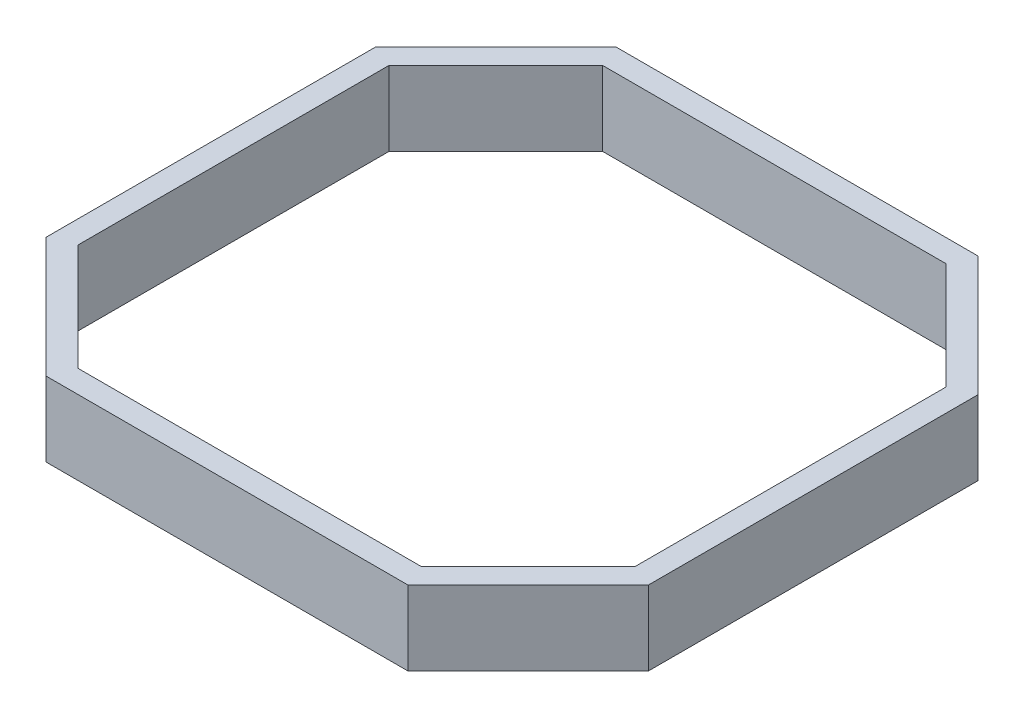
from build123d import *

# Parameters (mm, degrees)
BOSS_EXTRUDE1_DEPTH = 11.5


with BuildPart() as part:
    # Sketch1 → Boss-Extrude1 (new body)
    with BuildSketch(Plane(origin=(0, 0, 0), x_dir=(1, 0, 0), z_dir=(0, 1, 0))):
        Polygon((-46.5, 25.449747468), (-27.949747468, 44), (27.949747468, 44), (46.5, 25.449747468), (46.5, -25.449747468), (27.949747468, -44), (-27.949747468, -44), (-46.5, -25.449747468), align=None)
        Polygon((-43, 24), (-26.5, 40.5), (26.5, 40.5), (43, 24), (43, -24), (26.5, -40.5), (-26.5, -40.5), (-43, -24), align=None, mode=Mode.SUBTRACT)
    extrude(amount=BOSS_EXTRUDE1_DEPTH)


solid = part.part
